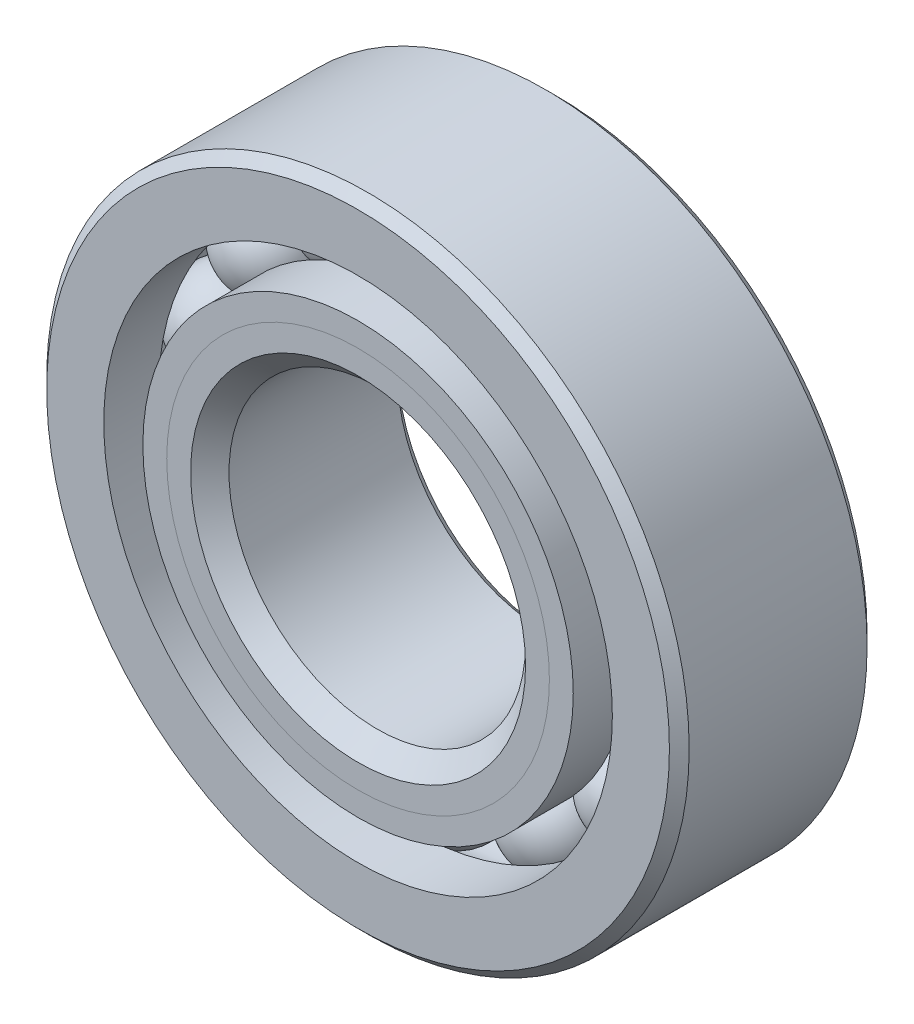
from build123d import *

# Parameters (mm, degrees)
CIRPATTERN1_COUNT = 14


with BuildPart() as part:
    # Sketch1 → Revolve1 (revolve)
    with BuildSketch(Plane(origin=(0, 0, 0), x_dir=(0, 0, -1), z_dir=(1, 0, 0))):
        with BuildLine():
            Line((5.715, 20.6375), (-5.715, 20.6375))
            Line((-5.715, 20.6375), (-6.35, 20.0025))
            Line((-6.35, 20.0025), (-6.35, 16.337293956))
            Line((-6.35, 16.337293956), (-2.822222222, 16.337293956))
            ThreePointArc((-2.822222222, 16.337293956), (0, 18.170357426), (2.822222222, 16.337293956))
            Line((2.822222222, 16.337293956), (6.35, 16.337293956))
            Line((6.35, 16.337293956), (6.35, 20.0025))
            Line((6.35, 20.0025), (5.715, 20.6375))
        make_face()
    revolve(axis=Axis((0, 0, 6.35), (0, 0, -1)))


with BuildPart() as body_2:
    # Sketch2 → Revolve2 (revolve)
    with BuildSketch(Plane(origin=(0, 0, 0), x_dir=(0, 0, -1), z_dir=(1, 0, 0))):
        with BuildLine():
            Line((-6.35, 13.825206044), (-2.822222222, 13.825206044))
            ThreePointArc((-2.822222222, 13.825206044), (-1.682636321, 12.490628511), (0, 11.992142574))
            Line((0, 11.992142574), (0, 10.758571287))
            Line((0, 10.758571287), (-4.816682621, 10.758571287))
            Line((-4.816682621, 10.758571287), (-6.35, 12.291888665))
            Line((-6.35, 12.291888665), (-6.35, 13.825206044))
        make_face()
    revolve(axis=Axis((0, 0, 6.35), (0, 0, -1)))


with BuildPart() as body_3:
    # Sketch3 → Revolve3 (revolve)
    with BuildSketch(Plane(origin=(0, 0, 0), x_dir=(0, 0, -1), z_dir=(1, 0, 0))):
        with BuildLine():
            Line((-6.35, 12.291888665), (-4.816682621, 10.758571287))
            Line((-4.816682621, 10.758571287), (0, 10.758571287))
            Line((0, 10.758571287), (0, 11.992142574))
            ThreePointArc((0, 11.992142574), (1.682636321, 12.490628511), (2.822222222, 13.825206044))
            Line((2.822222222, 13.825206044), (6.35, 13.825206044))
            Line((6.35, 13.825206044), (6.35, 10.16))
            Line((6.35, 10.16), (5.715, 9.525))
            Line((5.715, 9.525), (-5.116428713, 9.525))
            Line((-5.116428713, 9.525), (-6.35, 10.758571287))
            Line((-6.35, 10.758571287), (-6.35, 12.291888665))
        make_face()
    revolve(axis=Axis((0, 0, 6.35), (0, 0, -1)))


with BuildPart() as body_4:
    # Sketch4 → Revolve4 (revolve)
    with BuildSketch(Plane(origin=(0, 0, 0), x_dir=(0, 0, -1), z_dir=(1, 0, 0))):
        with BuildLine():
            Line((-3.089107426, 15.08125), (3.089107426, 15.08125))
            ThreePointArc((3.089107426, 15.08125), (0, 18.170357426), (-3.089107426, 15.08125))
        make_face()
    revolve(axis=Axis((0, 15.08125, 3.089107426), (0, 0, -1)))


with BuildPart() as cirpattern1_1:
    # CirPattern1: pattern copy
    add(body_4.part.rotate(Axis((0, 0, -6.35), (0, 0, 1)), 1 * 360 / CIRPATTERN1_COUNT))


with BuildPart() as cirpattern1_2:
    # CirPattern1: pattern copy
    add(body_4.part.rotate(Axis((0, 0, -6.35), (0, 0, 1)), 2 * 360 / CIRPATTERN1_COUNT))


with BuildPart() as cirpattern1_3:
    # CirPattern1: pattern copy
    add(body_4.part.rotate(Axis((0, 0, -6.35), (0, 0, 1)), 3 * 360 / CIRPATTERN1_COUNT))


with BuildPart() as cirpattern1_4:
    # CirPattern1: pattern copy
    add(body_4.part.rotate(Axis((0, 0, -6.35), (0, 0, 1)), 4 * 360 / CIRPATTERN1_COUNT))


with BuildPart() as cirpattern1_5:
    # CirPattern1: pattern copy
    add(body_4.part.rotate(Axis((0, 0, -6.35), (0, 0, 1)), 5 * 360 / CIRPATTERN1_COUNT))


with BuildPart() as cirpattern1_6:
    # CirPattern1: pattern copy
    add(body_4.part.rotate(Axis((0, 0, -6.35), (0, 0, 1)), 6 * 360 / CIRPATTERN1_COUNT))


with BuildPart() as cirpattern1_7:
    # CirPattern1: pattern copy
    add(body_4.part.rotate(Axis((0, 0, -6.35), (0, 0, 1)), 7 * 360 / CIRPATTERN1_COUNT))


with BuildPart() as cirpattern1_8:
    # CirPattern1: pattern copy
    add(body_4.part.rotate(Axis((0, 0, -6.35), (0, 0, 1)), 8 * 360 / CIRPATTERN1_COUNT))


with BuildPart() as cirpattern1_9:
    # CirPattern1: pattern copy
    add(body_4.part.rotate(Axis((0, 0, -6.35), (0, 0, 1)), 9 * 360 / CIRPATTERN1_COUNT))


with BuildPart() as cirpattern1_10:
    # CirPattern1: pattern copy
    add(body_4.part.rotate(Axis((0, 0, -6.35), (0, 0, 1)), 10 * 360 / CIRPATTERN1_COUNT))


with BuildPart() as cirpattern1_11:
    # CirPattern1: pattern copy
    add(body_4.part.rotate(Axis((0, 0, -6.35), (0, 0, 1)), 11 * 360 / CIRPATTERN1_COUNT))


with BuildPart() as cirpattern1_12:
    # CirPattern1: pattern copy
    add(body_4.part.rotate(Axis((0, 0, -6.35), (0, 0, 1)), 12 * 360 / CIRPATTERN1_COUNT))


with BuildPart() as cirpattern1_13:
    # CirPattern1: pattern copy
    add(body_4.part.rotate(Axis((0, 0, -6.35), (0, 0, 1)), 13 * 360 / CIRPATTERN1_COUNT))


solid = Compound([part.part, body_2.part, body_3.part, body_4.part, cirpattern1_1.part, cirpattern1_2.part, cirpattern1_3.part, cirpattern1_4.part, cirpattern1_5.part, cirpattern1_6.part, cirpattern1_7.part, cirpattern1_8.part, cirpattern1_9.part, cirpattern1_10.part, cirpattern1_11.part, cirpattern1_12.part, cirpattern1_13.part])
